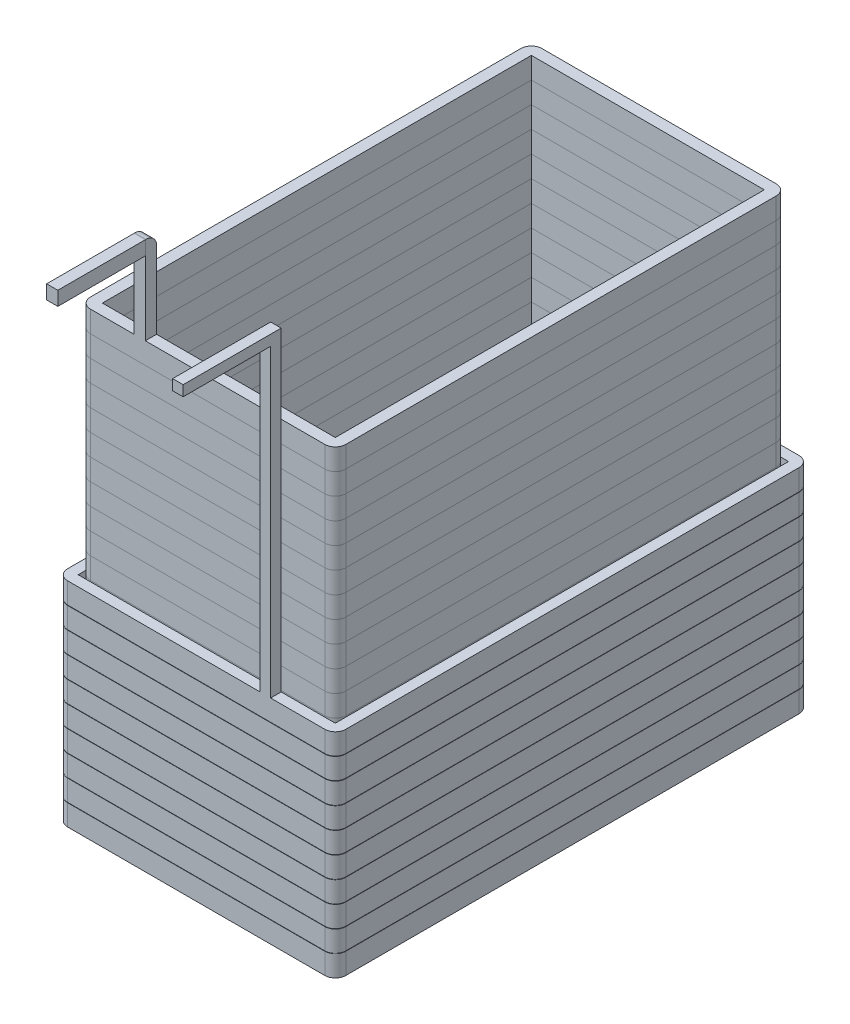
from build123d import *

# Parameters (mm, degrees)
SKETCH1_W           = 66.52
SKETCH1_H           = 122.52
BOSS_EXTRUDE2_DEPTH = 6.1
LPATTERN2_COUNT     = 21
LPATTERN2_PITCH     = 6.1
SKETCH2_W           = 3.189508196
SKETCH2_H           = 3.2
BOSS_EXTRUDE3_DEPTH = 25
SKETCH3_W           = 3.189508196
SKETCH3_H           = 4
BOSS_EXTRUDE4_DEPTH = 25
FILLET1_R           = 3
SKETCH4_W           = 73.44
SKETCH4_H           = 129.44
BOSS_EXTRUDE5_DEPTH = 6
LPATTERN3_COUNT     = 10
LPATTERN3_PITCH     = 6.1
SKETCH5_W           = 3
SKETCH5_H           = 3
BOSS_EXTRUDE6_DEPTH = 90
SKETCH6_W           = 3
SKETCH6_H           = 3
BOSS_EXTRUDE7_DEPTH = 25


with BuildPart() as part:
    # Sketch1 → Boss-Extrude2 (new body)
    with BuildSketch(Plane(origin=(0, 0, 0), x_dir=(1, 0, 0), z_dir=(0, 1, 0))):
        with BuildLine():
            Line((33.46, 64.46), (-33.46, 64.46))
            ThreePointArc((-33.46, 64.46), (-35.581320344, 63.581320344), (-36.46, 61.46))
            Line((-36.46, 61.46), (-36.46, -61.46))
            ThreePointArc((-36.46, -61.46), (-35.581320344, -63.581320344), (-33.46, -64.46))
            Line((-33.46, -64.46), (33.46, -64.46))
            ThreePointArc((33.46, -64.46), (35.581320344, -63.581320344), (36.46, -61.46))
            Line((36.46, -61.46), (36.46, 61.46))
            ThreePointArc((36.46, 61.46), (35.581320344, 63.581320344), (33.46, 64.46))
        make_face()
        Rectangle(SKETCH1_W, SKETCH1_H, mode=Mode.SUBTRACT)
    extrude(amount=BOSS_EXTRUDE2_DEPTH)


with BuildPart() as lpattern2_1:
    # LPattern2: pattern copy
    add(part.part.moved(Location(Vector(0, 1, 0) * (1 * LPATTERN2_PITCH))))


with BuildPart() as lpattern2_2:
    # LPattern2: pattern copy
    add(part.part.moved(Location(Vector(0, 1, 0) * (2 * LPATTERN2_PITCH))))


with BuildPart() as lpattern2_3:
    # LPattern2: pattern copy
    add(part.part.moved(Location(Vector(0, 1, 0) * (3 * LPATTERN2_PITCH))))


with BuildPart() as lpattern2_4:
    # LPattern2: pattern copy
    add(part.part.moved(Location(Vector(0, 1, 0) * (4 * LPATTERN2_PITCH))))


with BuildPart() as lpattern2_5:
    # LPattern2: pattern copy
    add(part.part.moved(Location(Vector(0, 1, 0) * (5 * LPATTERN2_PITCH))))


with BuildPart() as lpattern2_6:
    # LPattern2: pattern copy
    add(part.part.moved(Location(Vector(0, 1, 0) * (6 * LPATTERN2_PITCH))))


with BuildPart() as lpattern2_7:
    # LPattern2: pattern copy
    add(part.part.moved(Location(Vector(0, 1, 0) * (7 * LPATTERN2_PITCH))))


with BuildPart() as lpattern2_8:
    # LPattern2: pattern copy
    add(part.part.moved(Location(Vector(0, 1, 0) * (8 * LPATTERN2_PITCH))))


with BuildPart() as lpattern2_9:
    # LPattern2: pattern copy
    add(part.part.moved(Location(Vector(0, 1, 0) * (9 * LPATTERN2_PITCH))))


with BuildPart() as lpattern2_10:
    # LPattern2: pattern copy
    add(part.part.moved(Location(Vector(0, 1, 0) * (10 * LPATTERN2_PITCH))))


with BuildPart() as lpattern2_11:
    # LPattern2: pattern copy
    add(part.part.moved(Location(Vector(0, 1, 0) * (11 * LPATTERN2_PITCH))))


with BuildPart() as lpattern2_12:
    # LPattern2: pattern copy
    add(part.part.moved(Location(Vector(0, 1, 0) * (12 * LPATTERN2_PITCH))))


with BuildPart() as lpattern2_13:
    # LPattern2: pattern copy
    add(part.part.moved(Location(Vector(0, 1, 0) * (13 * LPATTERN2_PITCH))))


with BuildPart() as lpattern2_14:
    # LPattern2: pattern copy
    add(part.part.moved(Location(Vector(0, 1, 0) * (14 * LPATTERN2_PITCH))))


with BuildPart() as lpattern2_15:
    # LPattern2: pattern copy
    add(part.part.moved(Location(Vector(0, 1, 0) * (15 * LPATTERN2_PITCH))))


with BuildPart() as lpattern2_16:
    # LPattern2: pattern copy
    add(part.part.moved(Location(Vector(0, 1, 0) * (16 * LPATTERN2_PITCH))))


with BuildPart() as lpattern2_17:
    # LPattern2: pattern copy
    add(part.part.moved(Location(Vector(0, 1, 0) * (17 * LPATTERN2_PITCH))))


with BuildPart() as lpattern2_18:
    # LPattern2: pattern copy
    add(part.part.moved(Location(Vector(0, 1, 0) * (18 * LPATTERN2_PITCH))))


with BuildPart() as lpattern2_19:
    # LPattern2: pattern copy
    add(part.part.moved(Location(Vector(0, 1, 0) * (19 * LPATTERN2_PITCH))))


with BuildPart() as lpattern2_20:
    # LPattern2: pattern copy
    add(part.part.moved(Location(Vector(0, 1, 0) * (20 * LPATTERN2_PITCH))))

    # Sketch2 → Boss-Extrude3 (add)
    with BuildSketch(Plane(origin=(0, 128.1, 0), x_dir=(1, 0, 0), z_dir=(0, 1, 0))):
        with Locations((-19.388852459, -62.86)):
            Rectangle(SKETCH2_W, SKETCH2_H)
    extrude(amount=BOSS_EXTRUDE3_DEPTH)

    # Fillet1
    fillet1_edges = [lpattern2_20.edges().sort_by_distance(p)[0] for p in [
        (-19.388852459, 153.1, 61.26),
    ]]
    fillet(fillet1_edges, radius=FILLET1_R)


with BuildPart() as body_22:
    # Sketch3 → Boss-Extrude4 (new body)
    with BuildSketch(Plane.XY.offset(64.46)):
        with Locations((-19.388852459, 151.1)):
            Rectangle(SKETCH3_W, SKETCH3_H)
    extrude(amount=BOSS_EXTRUDE4_DEPTH)


with BuildPart() as body_23:
    # Sketch4 → Boss-Extrude5 (new body)
    with BuildSketch(Plane(origin=(0, 0, 0), x_dir=(-1, 0, 0), z_dir=(0, -1, 0))):
        with BuildLine():
            Line((-36.72, -67.72), (36.72, -67.72))
            ThreePointArc((36.72, -67.72), (38.841320344, -66.841320344), (39.72, -64.72))
            Line((39.72, -64.72), (39.72, 64.72))
            ThreePointArc((39.72, 64.72), (38.841320344, 66.841320344), (36.72, 67.72))
            Line((36.72, 67.72), (-36.72, 67.72))
            ThreePointArc((-36.72, 67.72), (-38.841320344, 66.841320344), (-39.72, 64.72))
            Line((-39.72, 64.72), (-39.72, -64.72))
            ThreePointArc((-39.72, -64.72), (-38.841320344, -66.841320344), (-36.72, -67.72))
        make_face()
        Rectangle(SKETCH4_W, SKETCH4_H, mode=Mode.SUBTRACT)
    extrude(amount=-BOSS_EXTRUDE5_DEPTH)


with BuildPart() as lpattern3_1:
    # LPattern3: pattern copy
    add(body_23.part.moved(Location(Vector(0, 1, 0) * (1 * LPATTERN3_PITCH))))


with BuildPart() as lpattern3_2:
    # LPattern3: pattern copy
    add(body_23.part.moved(Location(Vector(0, 1, 0) * (2 * LPATTERN3_PITCH))))


with BuildPart() as lpattern3_3:
    # LPattern3: pattern copy
    add(body_23.part.moved(Location(Vector(0, 1, 0) * (3 * LPATTERN3_PITCH))))


with BuildPart() as lpattern3_4:
    # LPattern3: pattern copy
    add(body_23.part.moved(Location(Vector(0, 1, 0) * (4 * LPATTERN3_PITCH))))


with BuildPart() as lpattern3_5:
    # LPattern3: pattern copy
    add(body_23.part.moved(Location(Vector(0, 1, 0) * (5 * LPATTERN3_PITCH))))


with BuildPart() as lpattern3_6:
    # LPattern3: pattern copy
    add(body_23.part.moved(Location(Vector(0, 1, 0) * (6 * LPATTERN3_PITCH))))


with BuildPart() as lpattern3_7:
    # LPattern3: pattern copy
    add(body_23.part.moved(Location(Vector(0, 1, 0) * (7 * LPATTERN3_PITCH))))


with BuildPart() as lpattern3_8:
    # LPattern3: pattern copy
    add(body_23.part.moved(Location(Vector(0, 1, 0) * (8 * LPATTERN3_PITCH))))


with BuildPart() as lpattern3_9:
    # LPattern3: pattern copy
    add(body_23.part.moved(Location(Vector(0, 1, 0) * (9 * LPATTERN3_PITCH))))

    # Sketch5 → Boss-Extrude6 (add)
    with BuildSketch(Plane(origin=(0, 60.9, 0), x_dir=(1, 0, 0), z_dir=(0, 1, 0))):
        with Locations((19.76, -66.22)):
            Rectangle(SKETCH5_W, SKETCH5_H)
    extrude(amount=BOSS_EXTRUDE6_DEPTH)

    # Sketch6 → Boss-Extrude7 (add)
    with BuildSketch(Plane.XY.offset(67.72)):
        with Locations((19.76, 149.4)):
            Rectangle(SKETCH6_W, SKETCH6_H)
    extrude(amount=BOSS_EXTRUDE7_DEPTH)


solid = Compound([part.part, lpattern2_1.part, lpattern2_2.part, lpattern2_3.part, lpattern2_4.part, lpattern2_5.part, lpattern2_6.part, lpattern2_7.part, lpattern2_8.part, lpattern2_9.part, lpattern2_10.part, lpattern2_11.part, lpattern2_12.part, lpattern2_13.part, lpattern2_14.part, lpattern2_15.part, lpattern2_16.part, lpattern2_17.part, lpattern2_18.part, lpattern2_19.part, lpattern2_20.part, body_22.part, body_23.part, lpattern3_1.part, lpattern3_2.part, lpattern3_3.part, lpattern3_4.part, lpattern3_5.part, lpattern3_6.part, lpattern3_7.part, lpattern3_8.part, lpattern3_9.part])
